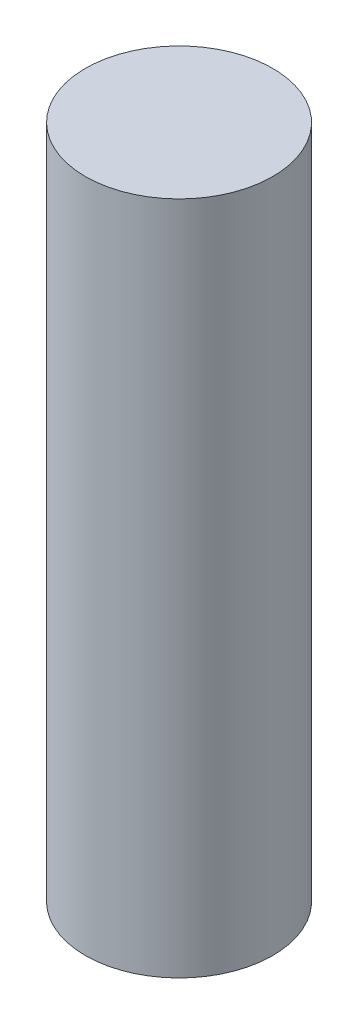
from build123d import *

# Parameters (mm, degrees)
SKETCH1_R           = 5
BOSS_EXTRUDE1_DEPTH = 18


with BuildPart() as part:
    # Sketch1 → Boss-Extrude1 (new, symmetric)
    with BuildSketch(Plane(origin=(0, 0, 0), x_dir=(1, 0, 0), z_dir=(0, 1, 0))):
        with Locations(Location((0, 0, 0), (0, 0, 270))):
            Circle(SKETCH1_R)
    extrude(amount=BOSS_EXTRUDE1_DEPTH, both=True)


solid = part.part
